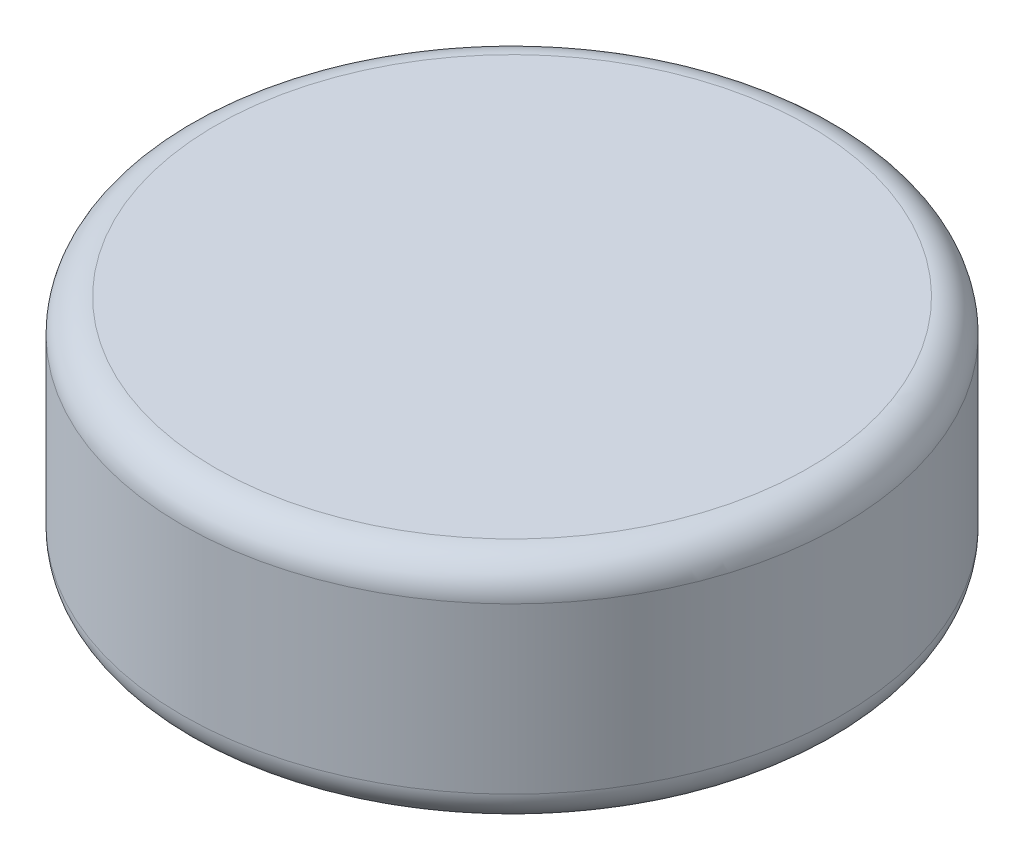
from build123d import *

# Parameters (mm, degrees)
SKETCH1_R           = 5
BOSS_EXTRUDE1_DEPTH = 3.5
FILLET1_R           = 0.5


with BuildPart() as part:
    # Sketch1 → Boss-Extrude1 (new body)
    with BuildSketch(Plane(origin=(0, 0, 0), x_dir=(1, 0, 0), z_dir=(0, 1, 0))):
        with Locations(Location((0, 0, 0), (0, 0, 270))):
            Circle(SKETCH1_R)
    extrude(amount=BOSS_EXTRUDE1_DEPTH)

    # Fillet1
    fillet1_edges = [part.edges().sort_by_distance(p)[0] for p in [
        (0, 0, -5),
        (0, 3.5, -5),
    ]]
    fillet(fillet1_edges, radius=FILLET1_R)


solid = part.part
